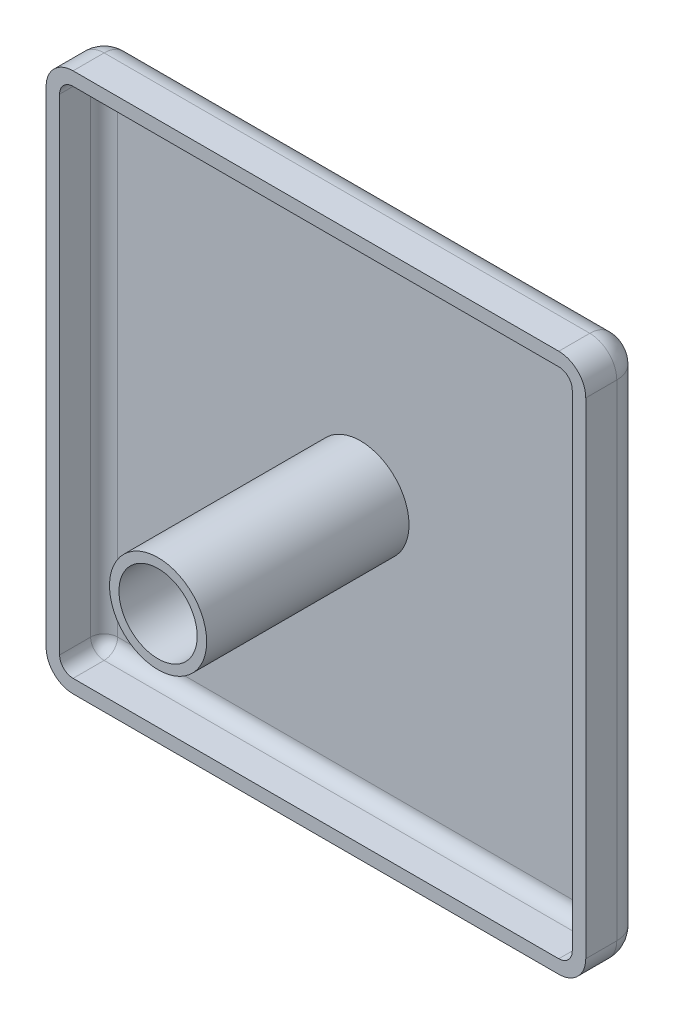
from build123d import *

# Parameters (mm, degrees)
SKETCH_1_W          = 40
SKETCH_1_H          = 40
EXTRUDE_1_DEPTH     = 4.3
FILLET_1_R          = 2
SHELL_1_T           = -1
SKETCH_2_R          = 3.6
EXTRUDE_2_DEPTH     = 15
SKETCH_3_R          = 2.9
CUT_EXTRUDE_1_DEPTH = 15


with BuildPart() as part:
    # 草图1 → 凸台-拉伸1 (new body)
    with BuildSketch(Plane.XY):
        Rectangle(SKETCH_1_W, SKETCH_1_H)
    extrude(amount=EXTRUDE_1_DEPTH)

    # 圆角1
    fillet_1_edges = [part.edges().sort_by_distance(p)[0] for p in [
        (0, -20, 0),
        (-20, 0, 0),
        (0, 20, 0),
        (20, 0, 0),
        (20, -20, 2.15),
        (-20, -20, 2.15),
        (-20, 20, 2.15),
        (20, 20, 2.15),
    ]]
    fillet(fillet_1_edges, radius=FILLET_1_R)

    # 抽壳1
    shell_1_openings = [part.faces().sort_by_distance(p)[0] for p in [
        (0, 0, 4.3),
    ]]
    offset(amount=SHELL_1_T, openings=shell_1_openings, kind=Kind.INTERSECTION)

    # 草图2 → 凸台-拉伸2 (add)
    with BuildSketch(Plane.XY.offset(1)):
        Circle(SKETCH_2_R)
    extrude(amount=EXTRUDE_2_DEPTH)

    # 草图3 → 切除-拉伸1 (cut)
    with BuildSketch(Plane.XY.offset(16)):
        Circle(SKETCH_3_R)
    extrude(amount=-CUT_EXTRUDE_1_DEPTH, mode=Mode.SUBTRACT)


solid = part.part
